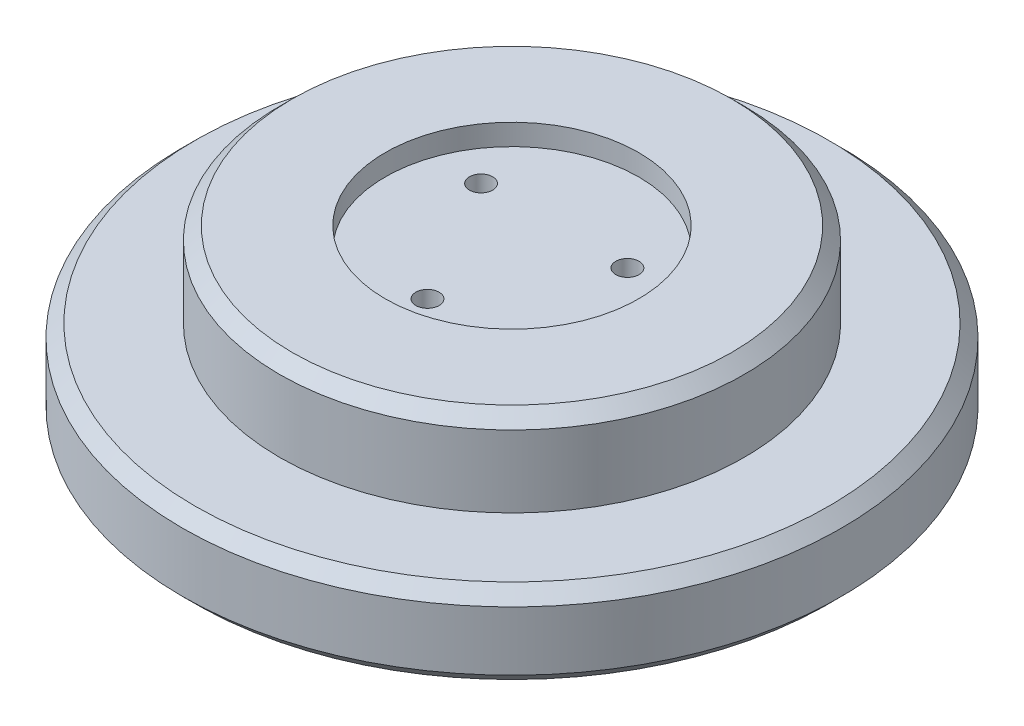
from build123d import *

# Parameters (mm, degrees)
M6X0_5_TAPPED_HOLE1_D = 5.5
CIRPATTERN1_COUNT     = 3
CHAMFER1_SIZE         = 3
SKETCH7_R             = 5
CUT_EXTRUDE1_DEPTH    = 5


with BuildPart() as part:
    # Sketch1 → Revolve1 (revolve)
    with BuildSketch(Plane(origin=(0, 0, 0), x_dir=(0, 0, -1), z_dir=(1, 0, 0))):
        Polygon((0, 0), (-78, 0), (-78, 20), (-55, 20), (-55, 40), (-30, 40), (-30, 35), (0, 35), align=None)
    revolve(axis=Axis((0, 226.154402008, 0), (0, -1, 0)))

    # M6x0.5 Tapped Hole1 (through all)
    with Locations(Plane(origin=(0, 0, 20), x_dir=(0, 0, -1), z_dir=(0, -1, 0))):
        with Locations((0, 0)):
            m6x0_5_tapped_hole1 = Hole(M6X0_5_TAPPED_HOLE1_D / 2)

    # CirPattern1: M6x0.5 Tapped Hole1 ×3 about axis
    cirpattern1_axis = Axis((0, 0, 0), (0, 1, 0))
    for i in range(1, CIRPATTERN1_COUNT):
        add(m6x0_5_tapped_hole1.rotate(cirpattern1_axis, i * 360 / CIRPATTERN1_COUNT), mode=Mode.SUBTRACT)

    # Chamfer1
    chamfer1_edges = [part.edges().sort_by_distance(p)[0] for p in [
        (0, 40, -55),
        (0, 20, -78),
        (0, 0, -78),
    ]]
    chamfer(chamfer1_edges, length=CHAMFER1_SIZE)

    # Sketch7 → Cut-Extrude1 (cut)
    with BuildSketch(Plane.XZ):
        with Locations(Location((0, 20, 0), (0, 0, 270))):
            Circle(SKETCH7_R)
        with Locations(Location((17.320508076, -10, 0), (0, 0, 270))):
            Circle(SKETCH7_R)
        with Locations(Location((-17.320508076, -10, 0), (0, 0, 270))):
            Circle(SKETCH7_R)
    extrude(amount=-CUT_EXTRUDE1_DEPTH, mode=Mode.SUBTRACT)


solid = part.part
